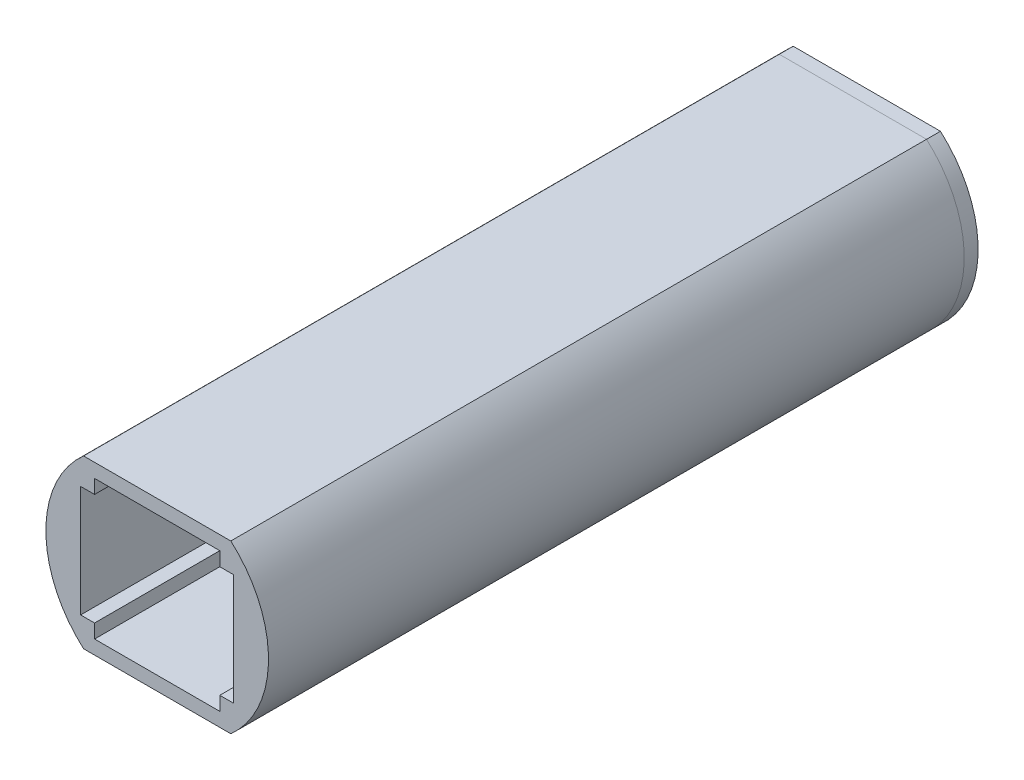
from build123d import *

# Parameters (mm, degrees)
BOSS_EXTRUDE1_DEPTH = 1
BOSS_EXTRUDE2_DEPTH = 50
CUT_EXTRUDE1_DEPTH  = 50
SKETCH5_R           = 4.5
CUT_EXTRUDE2_DEPTH  = 1


with BuildPart() as part:
    # Sketch2 → Boss-Extrude1 (new body)
    with BuildSketch(Plane.XY):
        with BuildLine():
            Line((-5.291502622, 6), (5.291502622, 6))
            ThreePointArc((5.291502622, 6), (8, 0), (5.291502622, -6))
            Line((5.291502622, -6), (-5.291502622, -6))
            ThreePointArc((-5.291502622, -6), (-8, 0), (-5.291502622, 6))
        make_face()
    extrude(amount=BOSS_EXTRUDE1_DEPTH)

    # Sketch5 → Cut-Extrude2 (cut)
    with BuildSketch(Plane(origin=(0, 0, 0), x_dir=(-1, 0, 0), z_dir=(0, 0, -1))):
        Circle(SKETCH5_R)
    extrude(amount=-CUT_EXTRUDE2_DEPTH, mode=Mode.SUBTRACT)


with BuildPart() as body_2:
    # Sketch3 → Boss-Extrude2 (new body)
    with BuildSketch(Plane.XY.offset(1)):
        with BuildLine():
            Line((-5.291502622, 6), (5.291502622, 6))
            ThreePointArc((5.291502622, 6), (8, 0), (5.291502622, -6))
            Line((5.291502622, -6), (-5.291502622, -6))
            ThreePointArc((-5.291502622, -6), (-8, 0), (-5.291502622, 6))
        make_face()
    extrude(amount=BOSS_EXTRUDE2_DEPTH)

    # Sketch4 → Cut-Extrude1 (cut)
    with BuildSketch(Plane.XY.offset(51)):
        Polygon((-4.5, 5), (-4.5, 4), (-5.5, 4), (-5.5, -4), (-4.5, -4), (-4.5, -5), (4.5, -5), (4.5, -4), (5.5, -4), (5.5, 4), (4.5, 4), (4.5, 5), align=None)
    extrude(amount=-CUT_EXTRUDE1_DEPTH, mode=Mode.SUBTRACT)


solid = Compound([part.part, body_2.part])
